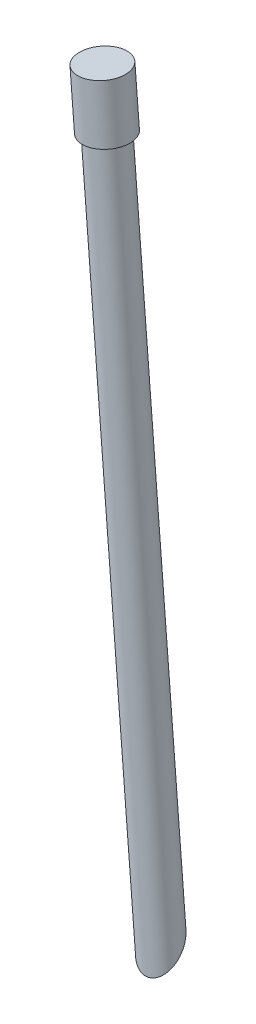
from build123d import *


with BuildPart() as part:
    # 草图1 → 旋转1 (revolve)
    with BuildSketch(Plane.XY, mode=Mode.PRIVATE) as revolve_1_sk:
        Polygon((3.050233699, 255.390679145), (5.031388725, 255.548486971), (5.425312632, 250.603077414), (5.0261176, 250.603077414), (9.960700437, 188.653211812), (8.376223588, 188.52700117), align=None)
    revolve(revolve_1_sk.sketch.rotate(Axis((2.315013939, 264.620793788, 0), (0.07940295498516195, -0.9968426007849105, 0)), 180), axis=Axis((2.315013939, 264.620793788, 0), (0.07940295498516195, -0.9968426007849105, 0)))

    # 草图2 → 切除-旋转1 (revolve, cut)
    with BuildSketch(Plane(origin=(0, 0, 0), x_dir=(0, 0, -1), z_dir=(1, 0, 0))):
        with BuildLine():
            Line((47.290942282, 71.880931487), (47.290942282, 211.279623848))
            ThreePointArc((47.290942282, 211.279623848), (-22.408403898, 141.580277667), (47.290942282, 71.880931487))
        make_face()
    revolve(axis=Axis((0, 235.002351216, -47.290942282), (0, -1, 0)), mode=Mode.SUBTRACT)


solid = part.part
